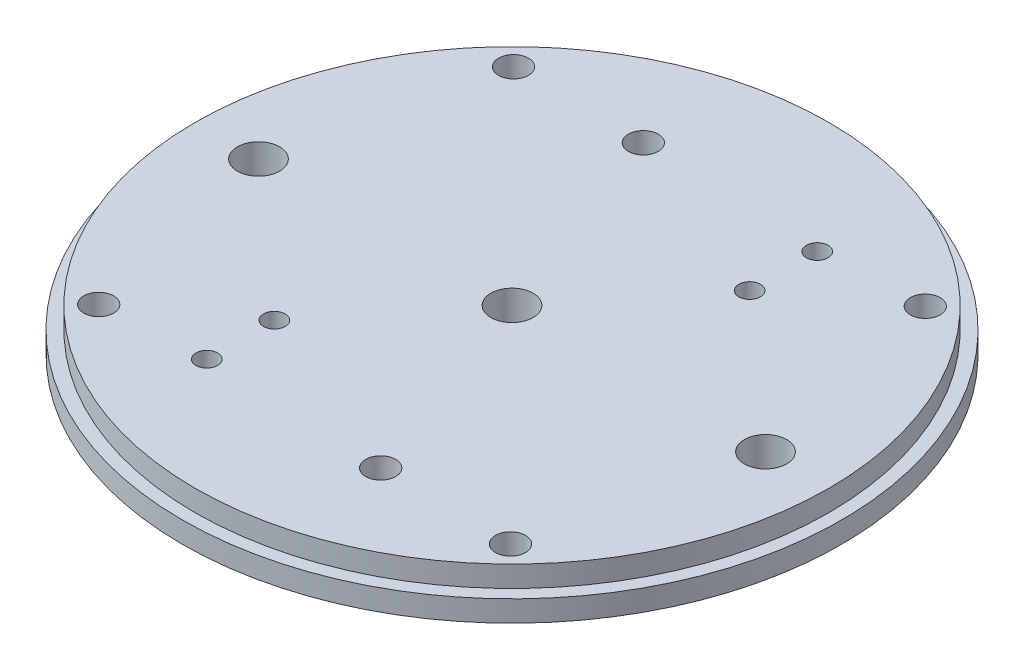
from build123d import *

# Parameters (mm, degrees)
SKETCH1_R                                      = 49.53
BOSS_EXTRUDE1_DEPTH                            = 3.175
SKETCH2_R                                      = 47.625
BOSS_EXTRUDE2_DEPTH                            = 3.175
SKETCH3_R                                      = 3.175
CUT_EXTRUDE1_DEPTH                             = 71.33323752
SKETCH5_R                                      = 3.175
CUT_EXTRUDE2_DEPTH                             = 71.33323752
CSK_FOR_8_FLAT_HEAD_MACHINE_SCREW2_D           = 4.4958
CSK_FOR_8_FLAT_HEAD_MACHINE_SCREW2_CSINK_D     = 8.4328
CSK_FOR_8_FLAT_HEAD_MACHINE_SCREW2_CSINK_ANGLE = 82
CIRPATTERN1_COUNT                              = 4
F_8_CLEARANCE_HOLE1_D                          = 4.4958
F_4_CLEARANCE_HOLE1_D                          = 3.2639


with BuildPart() as part:
    # Sketch1 → Boss-Extrude1 (new body)
    with BuildSketch(Plane(origin=(0, 0, 0), x_dir=(1, 0, 0), z_dir=(0, 1, 0))):
        with Locations(Location((0, 0, 0), (0, 0, 270))):
            Circle(SKETCH1_R)
    extrude(amount=BOSS_EXTRUDE1_DEPTH)

    # Sketch2 → Boss-Extrude2 (add)
    with BuildSketch(Plane(origin=(0, 3.175, 0), x_dir=(1, 0, 0), z_dir=(0, 1, 0))):
        with Locations(Location((0, 0, 0), (0, 0, 270))):
            Circle(SKETCH2_R)
    extrude(amount=BOSS_EXTRUDE2_DEPTH)

    # Sketch3 → Cut-Extrude1 (cut, through all)
    with BuildSketch(Plane(origin=(0, 6.35, 0), x_dir=(1, 0, 0), z_dir=(0, 1, 0))):
        with Locations(Location((-38.1, 0, 0), (0, 0, 270))):
            Circle(SKETCH3_R)
        with Locations(Location((38.1, 0, 0), (0, 0, 270))):
            Circle(SKETCH3_R)
    extrude(amount=-CUT_EXTRUDE1_DEPTH, mode=Mode.SUBTRACT)

    # Sketch5 → Cut-Extrude2 (cut, through all)
    with BuildSketch(Plane(origin=(0, 6.35, 0), x_dir=(1, 0, 0), z_dir=(0, 1, 0))):
        with Locations(Location((0, 0, 0), (0, 0, 270))):
            Circle(SKETCH5_R)
    extrude(amount=-CUT_EXTRUDE2_DEPTH, mode=Mode.SUBTRACT)

    # CSK for #8 Flat Head Machine Screw2 (through all)
    with Locations(Plane(origin=(0, 0, 0), x_dir=(-1, 0, 0), z_dir=(0, -1, 0))):
        with Locations((31.169774814, -30.940594366)):
            csk_for_8_flat_head_machine_screw2 = CounterSinkHole(CSK_FOR_8_FLAT_HEAD_MACHINE_SCREW2_D / 2, CSK_FOR_8_FLAT_HEAD_MACHINE_SCREW2_CSINK_D / 2, counter_sink_angle=CSK_FOR_8_FLAT_HEAD_MACHINE_SCREW2_CSINK_ANGLE)

    # CirPattern1: CSK for #8 Flat Head Machine Screw2 ×4 about axis
    cirpattern1_axis = Axis((0, 0, 0), (0, 1, 0))
    for i in range(1, CIRPATTERN1_COUNT):
        add(csk_for_8_flat_head_machine_screw2.rotate(cirpattern1_axis, i * 360 / CIRPATTERN1_COUNT), mode=Mode.SUBTRACT)

    # #8 Clearance Hole1 (through all)
    with Locations(Plane(origin=(0, 0, 0), x_dir=(-1, 0, 0), z_dir=(0, -1, 0))):
        with Locations((11.293505133, 31.028650338), (-11.293505133, -31.028650338)):
            Hole(F_8_CLEARANCE_HOLE1_D / 2)

    # #4 Clearance Hole1 (through all)
    with Locations(Plane(origin=(0, 0, 0), x_dir=(-1, 0, 0), z_dir=(0, -1, 0))):
        with Locations((-15.929774814, 19.783889264), (15.929774814, -19.783889264), (-15.929774814, 29.943889264), (15.929774814, -29.943889264)):
            Hole(F_4_CLEARANCE_HOLE1_D / 2)


solid = part.part
